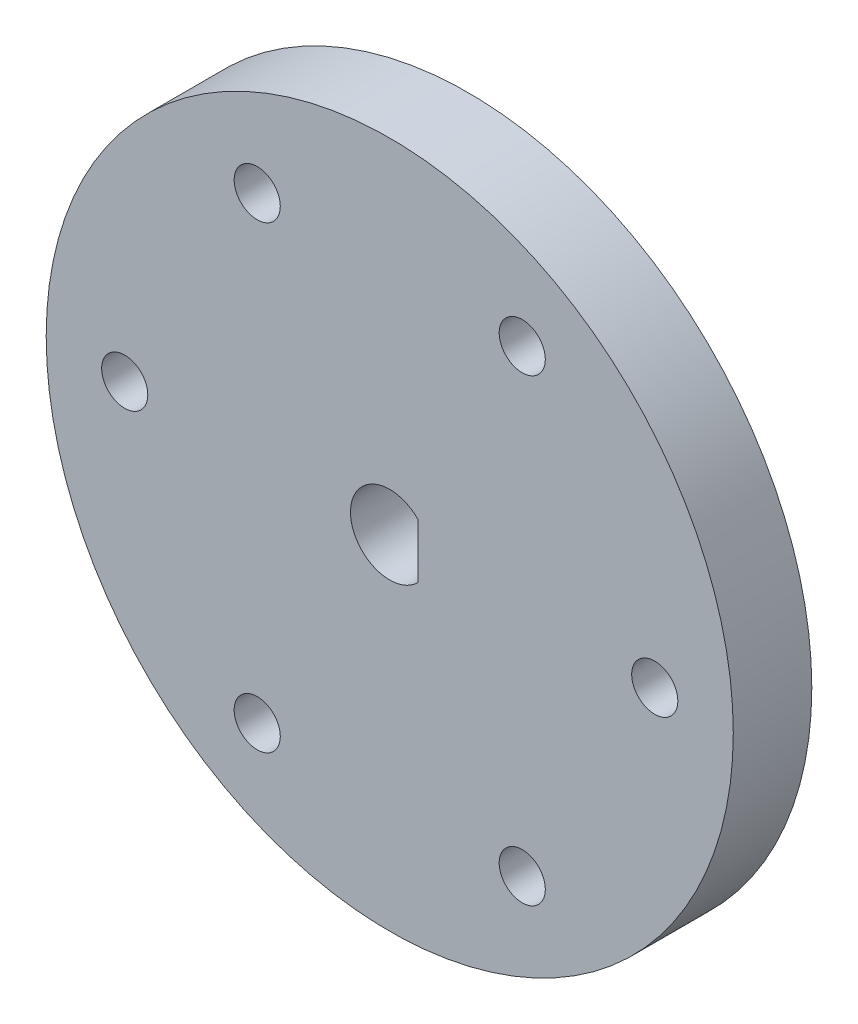
from build123d import *

# Parameters (mm, degrees)
CROQUIS1_R              = 35
SALIENTE_EXTRUIR1_DEPTH = 8
CROQUIS2_R              = 2.35
CORTAR_EXTRUIR1_DEPTH   = 5


with BuildPart() as part:
    # Croquis1 → Saliente-Extruir1 (new body)
    with BuildSketch(Plane.XY):
        Circle(CROQUIS1_R)
        with BuildLine():
            Line((2.90473751, 2.75), (2.90473751, -2.75))
            ThreePointArc((2.90473751, -2.75), (-4, 0), (2.90473751, 2.75))
        make_face(mode=Mode.SUBTRACT)
    extrude(amount=SALIENTE_EXTRUIR1_DEPTH)

    # Croquis2 → Cortar-Extruir1 (cut)
    with BuildSketch(Plane.XY.offset(8)):
        with Locations((27, 0)):
            Circle(CROQUIS2_R)
        with Locations((13.5, -23.382685902)):
            Circle(CROQUIS2_R)
        with Locations((-13.5, -23.382685902)):
            Circle(CROQUIS2_R)
        with Locations((-27, 0)):
            Circle(CROQUIS2_R)
        with Locations((-13.5, 23.382685902)):
            Circle(CROQUIS2_R)
        with Locations((13.5, 23.382685902)):
            Circle(CROQUIS2_R)
    extrude(amount=-CORTAR_EXTRUIR1_DEPTH, mode=Mode.SUBTRACT)


solid = part.part
